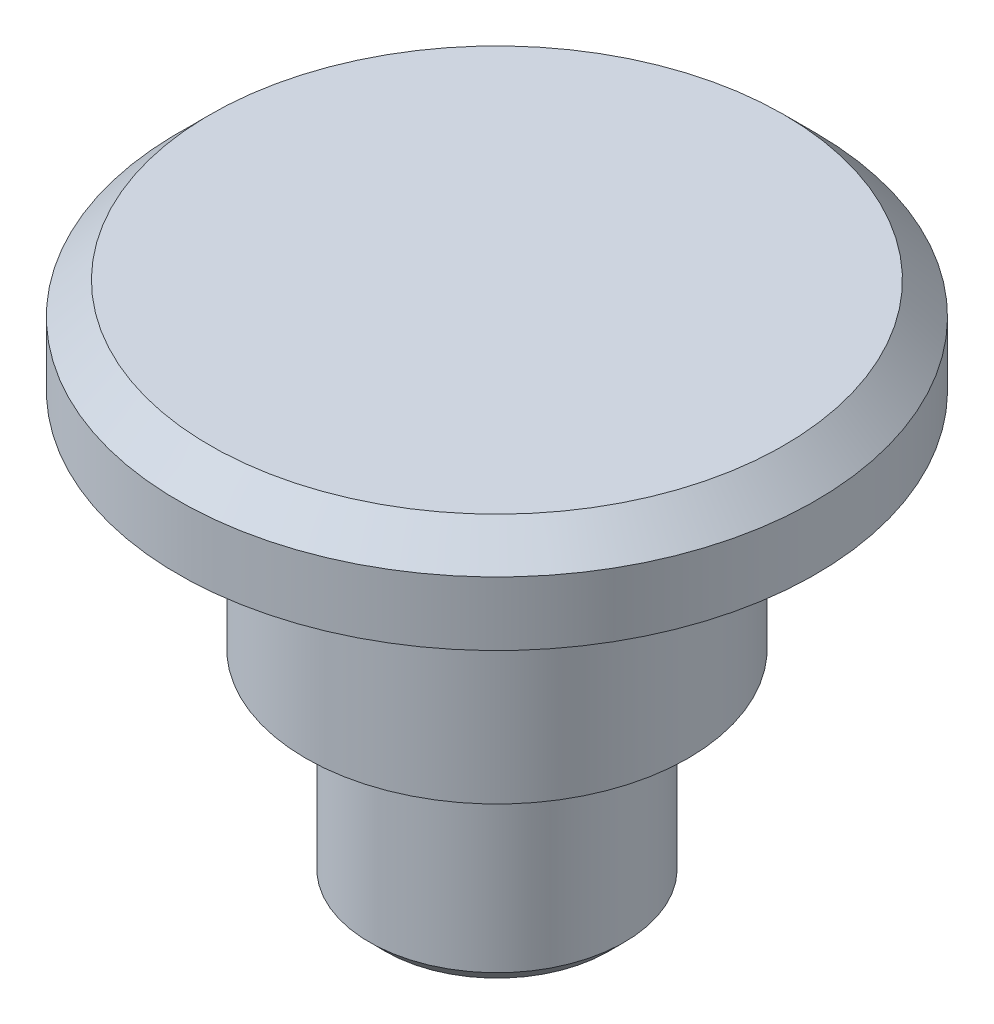
from build123d import *


with BuildPart() as part:
    # Esquisse1 → Base-Révolution (revolve)
    with BuildSketch(Plane.XY, mode=Mode.PRIVATE) as base_r_volution_sk:
        with BuildLine():
            Line((0, 0), (3.5, 0))
            Line((3.5, 0), (4, 0.5))
            Line((4, 0.5), (4, 6.5))
            ThreePointArc((4, 6.5), (4.3, 6.8), (4.6, 6.5))
            Line((4.6, 6.5), (6, 6.5))
            Line((6, 6.5), (6, 13.5))
            ThreePointArc((6, 13.5), (6.3, 13.8), (6.6, 13.5))
            Line((6.6, 13.5), (10, 13.5))
            Line((10, 13.5), (10, 15.5))
            Line((10, 15.5), (9, 16.5))
            Line((9, 16.5), (0, 16.5))
            Line((0, 16.5), (0, 0))
        make_face()
    revolve(base_r_volution_sk.sketch.rotate(Axis((0, 0, 0), (0, 1, 0)), 90), axis=Axis((0, 0, 0), (0, 1, 0)))


solid = part.part
